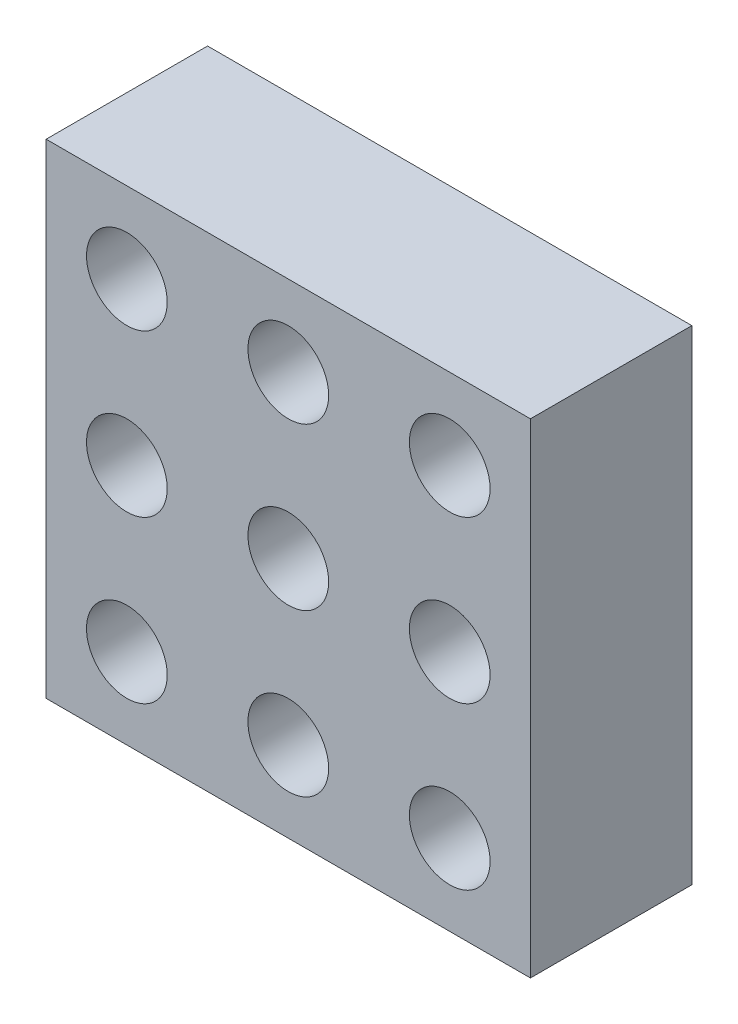
from build123d import *

# Parameters (mm, degrees)
SKETCH2_W            = 76.2
SKETCH2_H            = 76.2
BOSS_EXTRUDE1_DEPTH  = 25.4
SKETCH3_R            = 6.35
CUT_EXTRUDE1_DEPTH   = 111.716033166
LPATTERN1_COUNT      = 3
LPATTERN1_PITCH      = 25.4
LPATTERN1_COUNT_DIR2 = 3
LPATTERN1_PITCH_DIR2 = 25.4


with BuildPart() as part:
    # Sketch2 → Boss-Extrude1 (new body)
    with BuildSketch(Plane.XY):
        with Locations((38.1, 38.1)):
            Rectangle(SKETCH2_W, SKETCH2_H)
    extrude(amount=BOSS_EXTRUDE1_DEPTH)

    # Sketch3 → Cut-Extrude1 (cut, through all)
    with BuildSketch(Plane.XY.offset(25.4)):
        with Locations((12.7, 12.7)):
            Circle(SKETCH3_R)
    cut_extrude1 = extrude(amount=-CUT_EXTRUDE1_DEPTH, mode=Mode.SUBTRACT)

    # LPattern1: Cut-Extrude1 3 × 3
    with Locations(*[(j * LPATTERN1_PITCH_DIR2, i * LPATTERN1_PITCH, 0) for i in range(LPATTERN1_COUNT) for j in range(LPATTERN1_COUNT_DIR2) if (i, j) != (0, 0)]):
        add(cut_extrude1, mode=Mode.SUBTRACT)


solid = part.part
